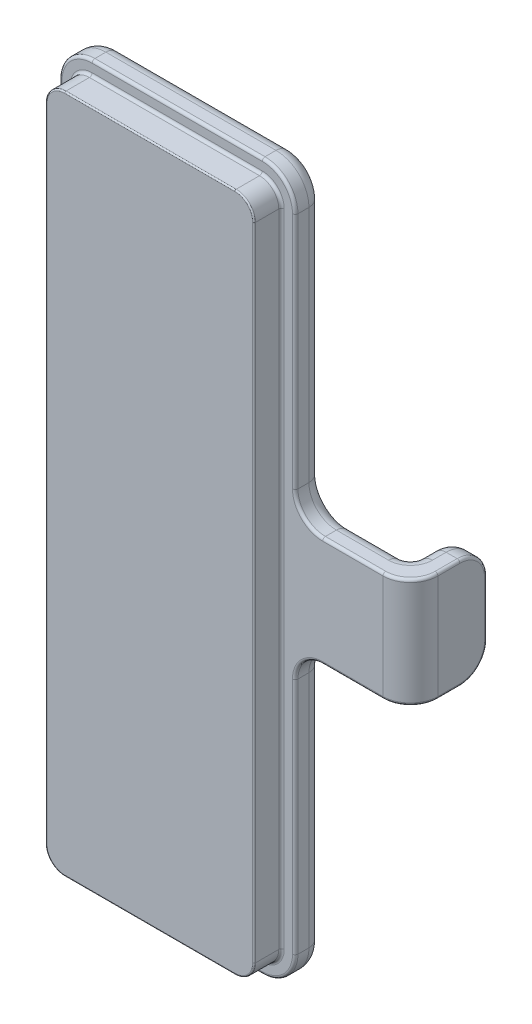
from build123d import *

# Parameters (mm, degrees)
SKETCH1_W           = 7.6
SKETCH1_H           = 24.769577967
BOSS_EXTRUDE1_DEPTH = 2
SKETCH2_W           = 8.6
SKETCH2_H           = 25.769577967
BOSS_EXTRUDE2_DEPTH = 1
SKETCH3_W           = 1
SKETCH3_H           = 4
BOSS_EXTRUDE3_DEPTH = 4.2
SKETCH4_W           = 1
SKETCH4_H           = 4
BOSS_EXTRUDE4_DEPTH = 1.8
FILLET1_R           = 1
FILLET2_R           = 0.3
FILLET3_R           = 1
FILLET4_R           = 1.2
FILLET5_R           = 0.7
FILLET6_R           = 0.1
FILLET7_R           = 0.05
FILLET8_R           = 0.5


with BuildPart() as part:
    # Sketch1 → Boss-Extrude1 (new body)
    with BuildSketch(Plane.XY):
        with Locations((24.075247947, -38.451880902)):
            Rectangle(SKETCH1_W, SKETCH1_H)
    extrude(amount=-BOSS_EXTRUDE1_DEPTH)

    # Sketch2 → Boss-Extrude2 (add)
    with BuildSketch(Plane(origin=(0, 0, -2), x_dir=(-1, 0, 0), z_dir=(0, 0, -1))):
        with Locations((-24.075247947, -38.451880902)):
            Rectangle(SKETCH2_W, SKETCH2_H)
    extrude(amount=-BOSS_EXTRUDE2_DEPTH)

    # Sketch3 → Boss-Extrude3 (add)
    with BuildSketch(Plane(origin=(28.375247947, -22.961421938, 0), x_dir=(0, 0, -1), z_dir=(-1, 0, 0))):
        with Locations((1.5, 15.490458963)):
            Rectangle(SKETCH3_W, SKETCH3_H)
    extrude(amount=-BOSS_EXTRUDE3_DEPTH)

    # Sketch4 → Boss-Extrude4 (add)
    with BuildSketch(Plane(origin=(65.150495893, 0, -2), x_dir=(1, 0, 0), z_dir=(0, 0, 1))):
        with Locations((-33.075247947, -38.451880902)):
            Rectangle(SKETCH4_W, SKETCH4_H)
    extrude(amount=-BOSS_EXTRUDE4_DEPTH)

    # Fillet1
    fillet1_edges = [part.edges().sort_by_distance(p)[0] for p in [
        (32.575247947, -38.451880902, -1),
    ]]
    fillet(fillet1_edges, radius=FILLET1_R)

    # Fillet2
    fillet2_edges = [part.edges().sort_by_distance(p)[0] for p in [
        (31.575247947, -38.451880902, -2),
    ]]
    fillet(fillet2_edges, radius=FILLET2_R)

    # Fillet3
    fillet3_edges = [part.edges().sort_by_distance(p)[0] for p in [
        (28.375247947, -40.451880902, -1.5),
        (28.375247947, -36.451880902, -1.5),
        (32.075247947, -36.451880902, -3.8),
        (32.075247947, -40.451880902, -3.8),
    ]]
    fillet(fillet3_edges, radius=FILLET3_R)

    # Fillet4
    fillet4_edges = [part.edges().sort_by_distance(p)[0] for p in [
        (28.375247947, -25.567091918, -1.5),
        (19.775247947, -25.567091918, -1.5),
        (19.775247947, -51.336669885, -1.5),
        (28.375247947, -51.336669885, -1.5),
    ]]
    fillet(fillet4_edges, radius=FILLET4_R)

    # Fillet5
    fillet5_edges = [part.edges().sort_by_distance(p)[0] for p in [
        (27.875247947, -26.067091918, -0.5),
        (20.275247947, -26.067091918, -0.5),
        (20.275247947, -50.836669885, -0.5),
        (27.875247947, -50.836669885, -0.5),
    ]]
    fillet(fillet5_edges, radius=FILLET5_R)

    # Fillet6
    fillet6_edges = [part.edges().sort_by_distance(p)[0] for p in [
        (24.075247947, -51.336669885, -1),
        (19.775247947, -38.451880902, -1),
        (28.375247947, -31.10948641, -1),
        (24.075247947, -25.567091918, -1),
        (28.023776084, -50.985198022, -1),
        (28.023776084, -25.918563781, -1),
        (20.126719809, -25.918563781, -1),
        (20.126719809, -50.985198022, -1),
        (27.875247947, -38.451880902, -1),
        (24.075247947, -26.067091918, -1),
        (20.275247947, -38.451880902, -1),
        (24.075247947, -50.836669885, -1),
        (27.670222693, -26.272117171, -1),
        (20.4802732, -26.272117171, -1),
        (20.4802732, -50.631644632, -1),
        (27.670222693, -50.631644632, -1),
        (30.475247947, -40.451880902, -1),
        (30.475247947, -36.451880902, -1),
        (32.575247947, -36.451880902, -2.4),
        (32.282354728, -36.451880902, -1.292893219),
        (32.282354728, -40.451880902, -1.292893219),
        (28.375247947, -45.794275393, -1),
        (32.575247947, -40.451880902, -2.4),
        (32.575247947, -38.451880902, -3.8),
        (32.575247947, -40.158987683, -3.507106781),
        (32.575247947, -36.74477412, -3.507106781),
        (28.668141165, -36.158987683, -1),
        (28.668141165, -40.74477412, -1),
    ]]
    fillet(fillet6_edges, radius=FILLET6_R)

    # Fillet7
    fillet7_edges = [part.edges().sort_by_distance(p)[0] for p in [
        (27.875247947, -38.451880902, 0),
        (24.075247947, -26.067091918, 0),
        (20.275247947, -38.451880902, 0),
        (24.075247947, -50.836669885, 0),
        (27.670222693, -50.631644632, 0),
        (20.4802732, -50.631644632, 0),
        (20.4802732, -26.272117171, 0),
        (27.670222693, -26.272117171, 0),
    ]]
    fillet(fillet7_edges, radius=FILLET7_R)

    # Fillet8
    fillet8_edges = [part.edges().sort_by_distance(p)[0] for p in [
        (24.075247947, -51.336669885, -2),
        (19.775247947, -38.451880902, -2),
        (24.075247947, -25.567091918, -2),
        (28.375247947, -31.10948641, -2),
        (28.023776084, -50.985198022, -2),
        (28.023776084, -25.918563781, -2),
        (20.126719809, -25.918563781, -2),
        (20.126719809, -50.985198022, -2),
        (30.325247947, -36.451880902, -2),
        (30.325247947, -40.451880902, -2),
        (31.487379981, -40.451880902, -2.087867966),
        (31.487379981, -36.451880902, -2.087867966),
        (31.575247947, -36.451880902, -2.55),
        (28.375247947, -45.794275393, -2),
        (31.575247947, -40.451880902, -2.55),
        (31.575247947, -38.451880902, -3.8),
        (31.575247947, -40.158987683, -3.507106781),
        (31.575247947, -36.74477412, -3.507106781),
        (28.668141165, -36.158987683, -2),
        (28.668141165, -40.74477412, -2),
    ]]
    fillet(fillet8_edges, radius=FILLET8_R)


solid = part.part
